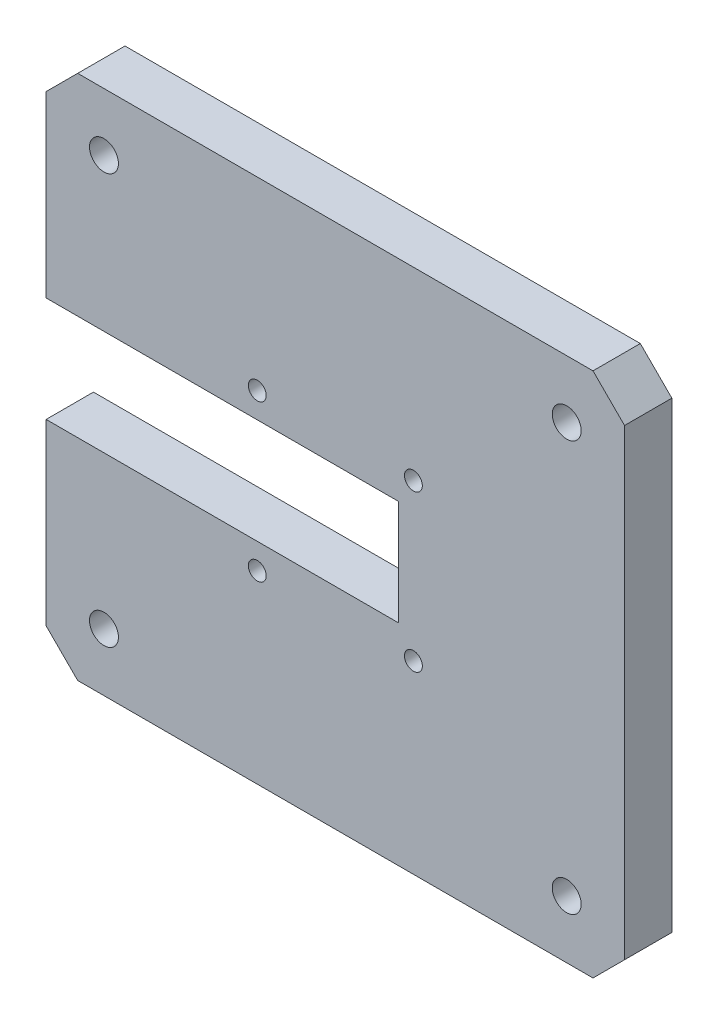
from build123d import *

# Parameters (mm, degrees)
SKETCH_1_R        = 3.75
SKETCH_1_R_2      = 2.75
EXTRUDE_250_DEPTH = 4
EXTRUDE_START     = 4
SKETCH_2_R        = 1.7
SKETCH_2_R_2      = 2.75
EXTRUDE_354_DEPTH = 5


with BuildPart() as part:
    # 草图1 → Extrude 250 (new body)
    with BuildSketch(Plane.XY):
        Polygon((-55, -44), (-49, -50), (49, -50), (55, -44), (55, 44), (49, 50), (-49, 50), (-55, 44), (-55, 10), (12, 10), (12, -10), (-55, -10), align=None)
        with Locations((-14.845, -14.845)):
            Circle(SKETCH_1_R, mode=Mode.SUBTRACT)
        with Locations((-14.845, 14.845)):
            Circle(SKETCH_1_R, mode=Mode.SUBTRACT)
        with Locations((14.845, -14.845)):
            Circle(SKETCH_1_R, mode=Mode.SUBTRACT)
        with Locations((14.845, 14.845)):
            Circle(SKETCH_1_R, mode=Mode.SUBTRACT)
        with Locations((-44, -39)):
            Circle(SKETCH_1_R_2, mode=Mode.SUBTRACT)
        with Locations((-44, 39)):
            Circle(SKETCH_1_R_2, mode=Mode.SUBTRACT)
        with Locations((44, -39)):
            Circle(SKETCH_1_R_2, mode=Mode.SUBTRACT)
        with Locations((44, 39)):
            Circle(SKETCH_1_R_2, mode=Mode.SUBTRACT)
    extrude(amount=EXTRUDE_250_DEPTH)

    # 草图2 → Extrude 354 (add)
    with BuildSketch(Plane.XY.offset(EXTRUDE_START)):
        Polygon((-55, -44), (-49, -50), (49, -50), (55, -44), (55, 44), (49, 50), (-49, 50), (-55, 44), (-55, 10), (12, 10), (12, -10), (-55, -10), align=None)
        with Locations((-14.845, -14.845)):
            Circle(SKETCH_2_R, mode=Mode.SUBTRACT)
        with Locations((-14.845, 14.845)):
            Circle(SKETCH_2_R, mode=Mode.SUBTRACT)
        with Locations((14.845, -14.845)):
            Circle(SKETCH_2_R, mode=Mode.SUBTRACT)
        with Locations((14.845, 14.845)):
            Circle(SKETCH_2_R, mode=Mode.SUBTRACT)
        with Locations((-44, -39)):
            Circle(SKETCH_2_R_2, mode=Mode.SUBTRACT)
        with Locations((-44, 39)):
            Circle(SKETCH_2_R_2, mode=Mode.SUBTRACT)
        with Locations((44, -39)):
            Circle(SKETCH_2_R_2, mode=Mode.SUBTRACT)
        with Locations((44, 39)):
            Circle(SKETCH_2_R_2, mode=Mode.SUBTRACT)
    extrude(amount=EXTRUDE_354_DEPTH)


solid = part.part
